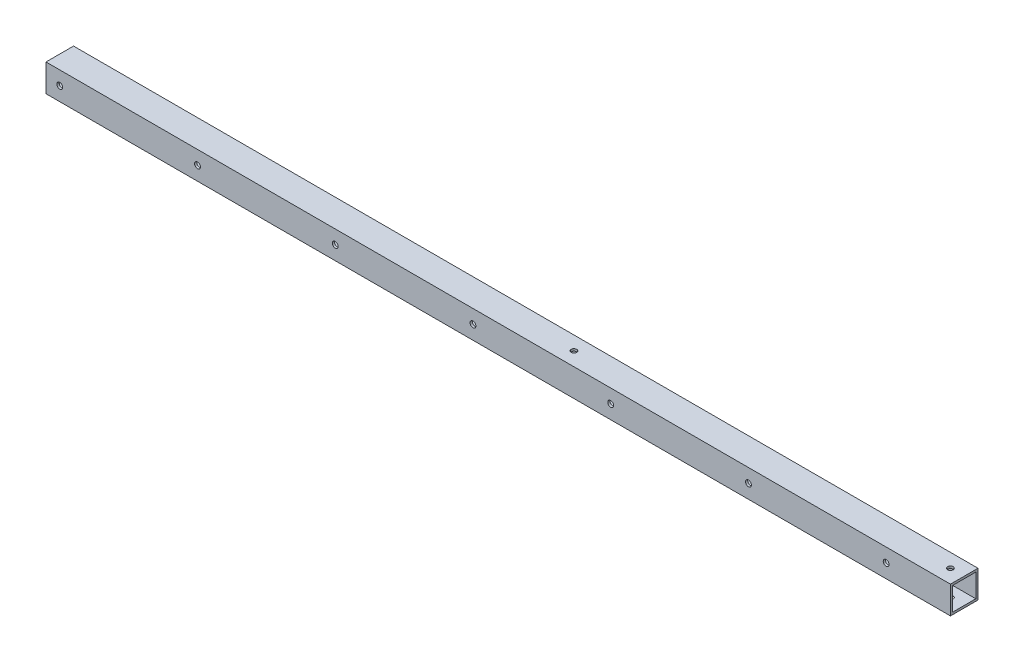
from build123d import *

# Parameters (mm, degrees)
SKETCH_2_W          = 492.5
SKETCH_2_H          = 15
SKETCH_2_R          = 1.6
EXTRUDE_1_DEPTH     = 15
SKETCH_3_W          = 12.6
SKETCH_3_H          = 12.6
CUT_EXTRUDE_1_DEPTH = 493.956641095
SKETCH_4_R          = 1.5
CUT_EXTRUDE_2_DEPTH = 493.956641095
CHAMFER_1_SIZE      = 1


with BuildPart() as part:
    # ｽｹｯﾁ2 → ﾎﾞｽ - 押し出し1 (new body)
    with BuildSketch(Plane.XY):
        with Locations((246.25, 7.5)):
            Rectangle(SKETCH_2_W, SKETCH_2_H)
        with Locations((7.5, 7.5)):
            Circle(SKETCH_2_R, mode=Mode.SUBTRACT)
        with Locations((457.5, 7.5)):
            Circle(SKETCH_2_R, mode=Mode.SUBTRACT)
        with Locations((232.5, 7.5)):
            Circle(SKETCH_2_R, mode=Mode.SUBTRACT)
        with Locations((82.5, 7.5)):
            Circle(SKETCH_2_R, mode=Mode.SUBTRACT)
        with Locations((157.5, 7.5)):
            Circle(SKETCH_2_R, mode=Mode.SUBTRACT)
        with Locations((307.5, 7.5)):
            Circle(SKETCH_2_R, mode=Mode.SUBTRACT)
        with Locations((382.5, 7.5)):
            Circle(SKETCH_2_R, mode=Mode.SUBTRACT)
    extrude(amount=EXTRUDE_1_DEPTH)

    # ｽｹｯﾁ3 → ｶｯﾄ - 押し出し1 (cut, through all)
    with BuildSketch(Plane(origin=(492.5, 0, 0), x_dir=(0, 0, -1), z_dir=(1, 0, 0))):
        with Locations((-7.5, 7.5)):
            Rectangle(SKETCH_3_W, SKETCH_3_H)
    extrude(amount=-CUT_EXTRUDE_1_DEPTH, mode=Mode.SUBTRACT)

    # ｽｹｯﾁ4 → ｶｯﾄ - 押し出し2 (cut, through all)
    with BuildSketch(Plane(origin=(0, 15, 0), x_dir=(1, 0, 0), z_dir=(0, 1, 0))):
        with Locations(Location((280, -7.5, 0), (0, 0, 180))):
            Circle(SKETCH_4_R)
        with Locations(Location((485, -7.5, 0), (0, 0, 180))):
            Circle(SKETCH_4_R)
    extrude(amount=-CUT_EXTRUDE_2_DEPTH, mode=Mode.SUBTRACT)

    # 面取り1
    chamfer_1_edges = [part.edges().sort_by_distance(p)[0] for p in [
        (281.5, 0, 7.5),
        (486.5, 0, 7.5),
    ]]
    chamfer(chamfer_1_edges, length=CHAMFER_1_SIZE)


solid = part.part
